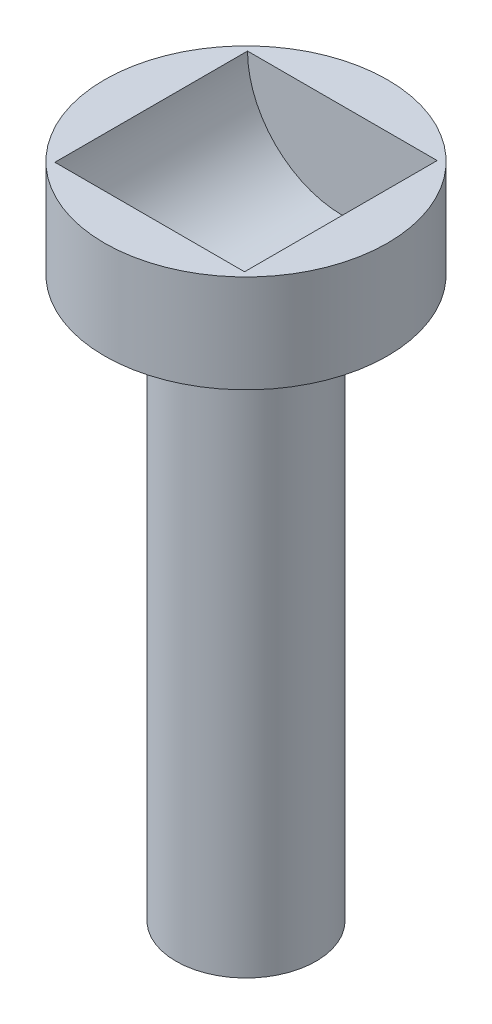
from build123d import *

# Parameters (mm, degrees)
SKETCH1_R               = 2.4
BOSS_EXTRUDE1_DEPTH     = 20
SKETCH2_R               = 1.195
CUT_EXTRUDE1_DEPTH      = 10
SKETCH4_R               = 4.85
BOSS_EXTRUDE2_DEPTH     = 2.54
BOSS_EXTRUDE3_START     = -3.35
SKETCH6_R               = 4.85
BOSS_EXTRUDE3_DEPTH     = 3.35
CUT_EXTRUDE3_DEPTH      = 3.3
CUT_EXTRUDE3_DEPTH_BACK = 3.302
SKETCH5_R               = 3.25


with BuildPart() as part:
    # Sketch1 → Boss-Extrude1 (new body)
    with BuildSketch(Plane(origin=(0, 0, 0), x_dir=(1, 0, 0), z_dir=(0, 1, 0))):
        with Locations(Location((0, 0, 0), (0, 0, 270))):
            Circle(SKETCH1_R)
    extrude(amount=BOSS_EXTRUDE1_DEPTH)

    # Sketch2 → Cut-Extrude1 (cut)
    with BuildSketch(Plane.XZ):
        with Locations(Location((0, 0, 0), (0, 0, 270))):
            Circle(SKETCH2_R)
    extrude(amount=-CUT_EXTRUDE1_DEPTH, mode=Mode.SUBTRACT)

    # Sketch4 → Boss-Extrude2 (add)
    with BuildSketch(Plane(origin=(0, 20, 0), x_dir=(1, 0, 0), z_dir=(0, 1, 0))):
        with Locations(Location((0, 0, 0), (0, 0, 270))):
            Circle(SKETCH4_R)
    extrude(amount=BOSS_EXTRUDE2_DEPTH)

    # Sketch6 → Boss-Extrude3 (add)
    with BuildSketch(Plane(origin=(0, 22.54, 0), x_dir=(1, 0, 0), z_dir=(0, 1, 0)).offset(BOSS_EXTRUDE3_START)):
        with Locations(Location((0, 0, 0), (0, 0, 270))):
            Circle(SKETCH6_R)
    extrude(amount=BOSS_EXTRUDE3_DEPTH)

    # Sketch5 → Cut-Extrude3 (cut, two sides: drawn at the far end of the back side and taken through both)
    with BuildSketch(Plane.XY.offset(-CUT_EXTRUDE3_DEPTH_BACK)):
        with Locations((0, 22.54)):
            Circle(SKETCH5_R)
    extrude(amount=CUT_EXTRUDE3_DEPTH + CUT_EXTRUDE3_DEPTH_BACK, mode=Mode.SUBTRACT)


solid = part.part
